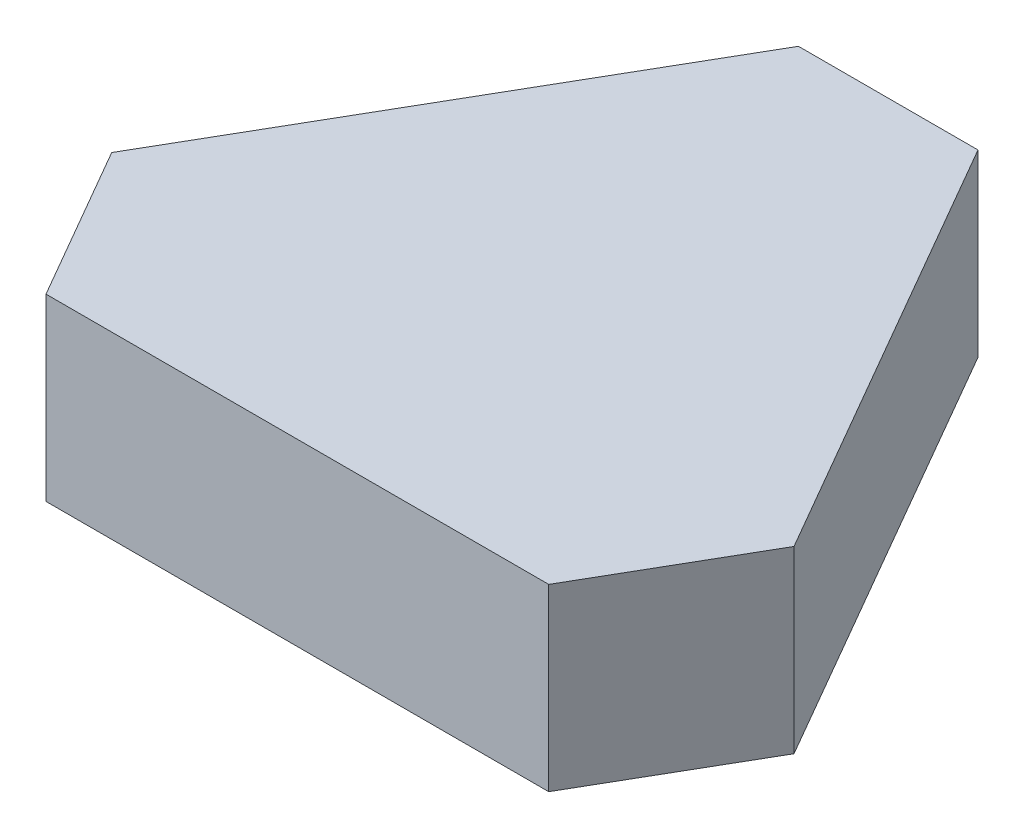
from build123d import *

# Parameters (mm, degrees)
ESTRUSIONE_ESTRUSIONE1_DEPTH = 5
TAGLIO_ESTRUSIONE1_DEPTH     = 10
RIPETIZIONECIRCOLARE1_COUNT  = 3


with BuildPart() as part:
    # Schizzo1 → Estrusione-Estrusione1 (new, symmetric)
    with BuildSketch(Plane(origin=(0, 0, 0), x_dir=(1, 0, 0), z_dir=(0, 1, 0))):
        Polygon((-24, -13.856406461), (0, 27.712812921), (24, -13.856406461), align=None)
    extrude(amount=ESTRUSIONE_ESTRUSIONE1_DEPTH, both=True)

    # Schizzo2 → Taglio-Estrusione1 (cut)
    with BuildSketch(Plane(origin=(0, 5, 0), x_dir=(1, 0, 0), z_dir=(0, 1, 0))):
        Polygon((14, -13.856406461), (19, -5.196152423), (24, -13.856406461), align=None)
    taglio_estrusione1 = extrude(amount=-TAGLIO_ESTRUSIONE1_DEPTH, mode=Mode.SUBTRACT)

    # RipetizioneCircolare1: Taglio-Estrusione1 ×3 about axis
    ripetizionecircolare1_axis = Axis((0, 0, 0), (0, 1, 0))
    for i in range(1, RIPETIZIONECIRCOLARE1_COUNT):
        add(taglio_estrusione1.rotate(ripetizionecircolare1_axis, i * 360 / RIPETIZIONECIRCOLARE1_COUNT), mode=Mode.SUBTRACT)


solid = part.part
